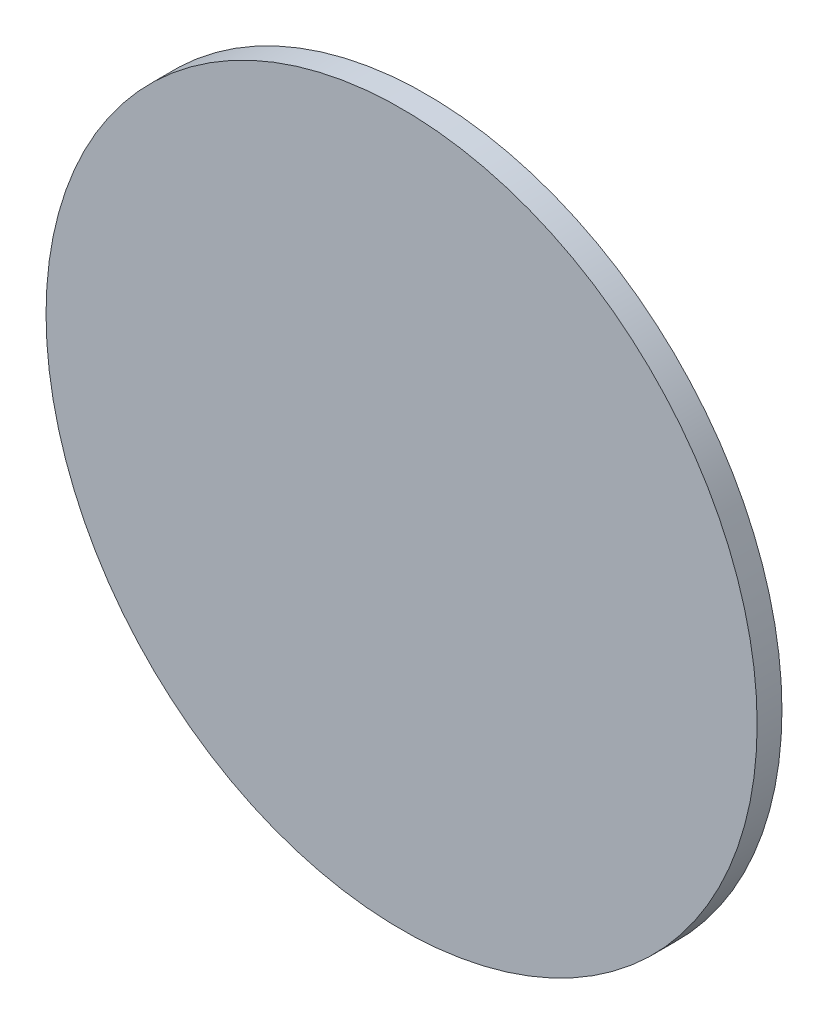
from build123d import *

# Parameters (mm, degrees)
EXTRUDE_START      = 317
EXTRUDE_SKETCH_1_R = 86
EXTRUDE_1_DEPTH    = 6
EXTRUDE_START_2    = 309
EXTRUDE_SKETCH_2_R = 10
EXTRUDE_2_DEPTH    = 8


with BuildPart() as part:
    # Extrude sketch 1 → Extrude 1 (new body)
    with BuildSketch(Plane.XY.offset(EXTRUDE_START)):
        with Locations((757.5, 0)):
            Circle(EXTRUDE_SKETCH_1_R)
    extrude(amount=EXTRUDE_1_DEPTH)


with BuildPart() as body_2:
    # Extrude sketch 2 → Extrude 2 (new body)
    with BuildSketch(Plane.XY.offset(EXTRUDE_START_2)):
        with Locations((757.5, 0)):
            Circle(EXTRUDE_SKETCH_2_R)
    extrude(amount=EXTRUDE_2_DEPTH)


with BuildPart() as part_1:
    add(part.part)

    # Combine (weld / assembly of features): union body 2
    add(body_2.part)


solid = part_1.part
